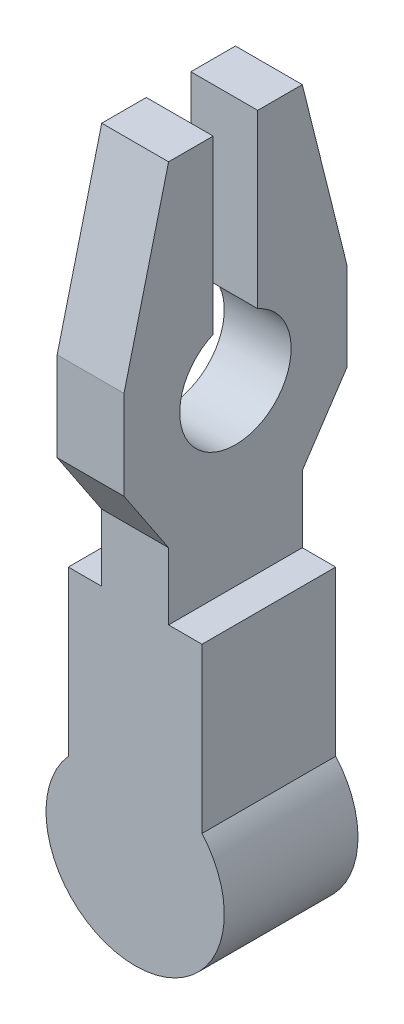
from build123d import *

# Parameters (mm, degrees)
CROQUIS1_R              = 40
SALIENTE_EXTRUIR1_DEPTH = 30
CROQUIS2_W              = 60
CROQUIS2_H              = 100
SALIENTE_EXTRUIR2_DEPTH = 30
SALIENTE_EXTRUIR3_DEPTH = 15


with BuildPart() as part:
    # Croquis1 → Saliente-Extruir1 (new, symmetric)
    with BuildSketch(Plane.XY):
        Circle(CROQUIS1_R)
    extrude(amount=SALIENTE_EXTRUIR1_DEPTH, both=True)

    # Croquis2 → Saliente-Extruir2 (add, symmetric)
    with BuildSketch(Plane.XY):
        with Locations((0, 50)):
            Rectangle(CROQUIS2_W, CROQUIS2_H)
    extrude(amount=SALIENTE_EXTRUIR2_DEPTH, both=True)

    # Croquis3 → Saliente-Extruir3 (add, symmetric)
    with BuildSketch(Plane(origin=(0, 0, 0), x_dir=(0, 0, -1), z_dir=(1, 0, 0))):
        with BuildLine():
            Line((-30, 130), (-30, 100))
            Line((-30, 100), (30, 100))
            Line((30, 100), (30, 130))
            Line((30, 130), (50, 160))
            Line((50, 160), (50, 200))
            Line((50, 200), (30, 280))
            Line((30, 280), (10, 280))
            Line((10, 280), (10, 202.912878475))
            ThreePointArc((10, 202.912878475), (0, 155), (-10, 202.912878475))
            Line((-10, 202.912878475), (-10, 280))
            Line((-10, 280), (-30, 280))
            Line((-30, 280), (-50, 200))
            Line((-50, 200), (-50, 160))
            Line((-50, 160), (-30, 130))
        make_face()
    extrude(amount=SALIENTE_EXTRUIR3_DEPTH, both=True)


solid = part.part
